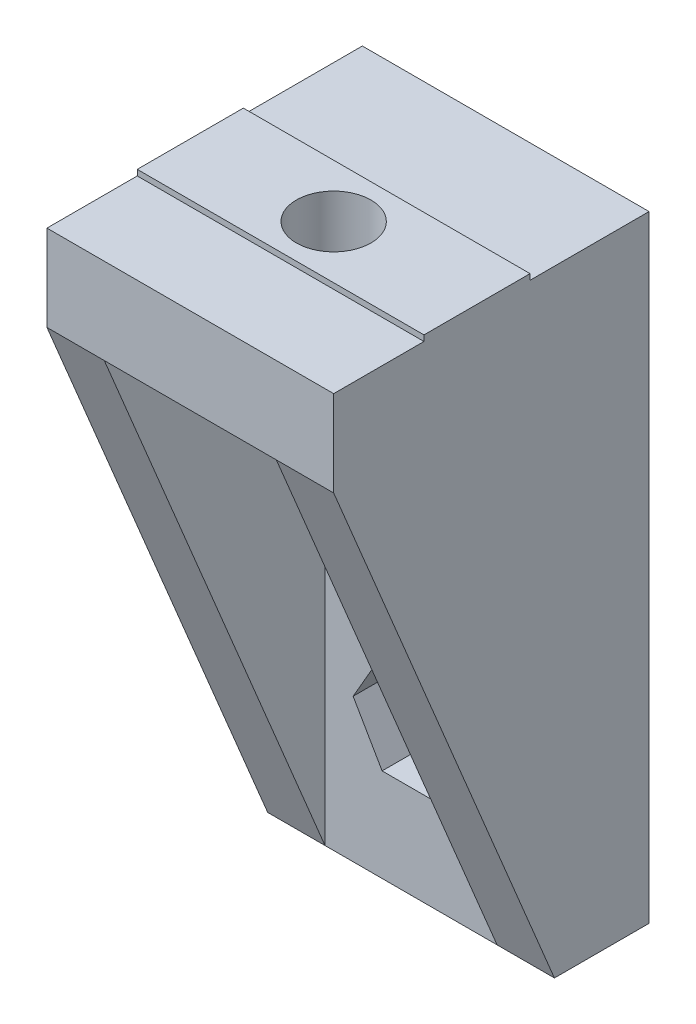
from build123d import *

# Parameters (mm, degrees)
SKETCH_3_W          = 20
SKETCH_3_H          = 37
EXTRUDE_2_DEPTH     = 6.6
SKETCH_10_R         = 2.2
CUT_EXTRUDE_3_DEPTH = 39.891644347
CUT_EXTRUDE_2_DEPTH = 3.4
SKETCH_11_W         = 20
SKETCH_11_H         = 22
EXTRUDE_5_DEPTH     = 6
SKETCH_9_W          = 20
SKETCH_9_H          = 7.4
EXTRUDE_4_DEPTH     = 0.4
SKETCH_13_R         = 2.6
CUT_EXTRUDE_4_DEPTH = 50.674540763
EXTRUDE_6_DEPTH     = 4


with BuildPart() as part:
    # Эскиз3 → Бобышка-Вытянуть2 (new body)
    with BuildSketch(Plane.XY):
        with Locations((0, 18.5)):
            Rectangle(SKETCH_3_W, SKETCH_3_H)
    extrude(amount=EXTRUDE_2_DEPTH)

    # Эскиз10 → Вырез-Вытянуть3 (cut, through all)
    with BuildSketch(Plane(origin=(0, 0, 0), x_dir=(-1, 0, 0), z_dir=(0, 0, -1))):
        with Locations((0, 10)):
            Circle(SKETCH_10_R)
    extrude(amount=-CUT_EXTRUDE_3_DEPTH, mode=Mode.SUBTRACT)

    # Эскиз6 → Вырез-Вытянуть2 (cut)
    with BuildSketch(Plane.XY.offset(6.6)):
        Polygon((4.041451884, 10), (2.020725942, 13.5), (-2.020725942, 13.5), (-4.041451884, 10), (-2.020725942, 6.5), (2.020725942, 6.5), align=None)
    extrude(amount=-CUT_EXTRUDE_2_DEPTH, mode=Mode.SUBTRACT)

    # Эскиз11 → Бобышка-Вытянуть5 (add)
    with BuildSketch(Plane(origin=(0, 37, 0), x_dir=(1, 0, 0), z_dir=(0, 1, 0))):
        with Locations((0, -11)):
            Rectangle(SKETCH_11_W, SKETCH_11_H)
    extrude(amount=EXTRUDE_5_DEPTH)

    # Эскиз9 → Бобышка-Вытянуть4 (add)
    with BuildSketch(Plane(origin=(0, 43, -43.4), x_dir=(1, 0, 0), z_dir=(0, -1, 0))):
        with Locations((0, 55.4)):
            Rectangle(SKETCH_9_W, SKETCH_9_H)
    extrude(amount=-EXTRUDE_4_DEPTH)

    # Эскиз13 → Вырез-Вытянуть4 (cut, through all)
    with BuildSketch(Plane(origin=(0, 43.4, 0), x_dir=(1, 0, 0), z_dir=(0, 1, 0))):
        with Locations(Location((0, -12, 0), (0, 0, 270))):
            Circle(SKETCH_13_R)
    extrude(amount=-CUT_EXTRUDE_4_DEPTH, mode=Mode.SUBTRACT)

    # Эскиз17 → Бобышка-Вытянуть6 (add)
    with BuildSketch(Plane.ZY.offset(10)):
        Polygon((22, 37), (6.6, 37), (6.6, 0), align=None)
    extrude_6 = extrude(amount=-EXTRUDE_6_DEPTH)

    # Зеркальное отражение1: Бобышка-Вытянуть6 across plane
    add(extrude_6.mirror(Plane(origin=(0, 0, 0), x_dir=(0, 0, 1), z_dir=(1, 0, 0))))


solid = part.part
